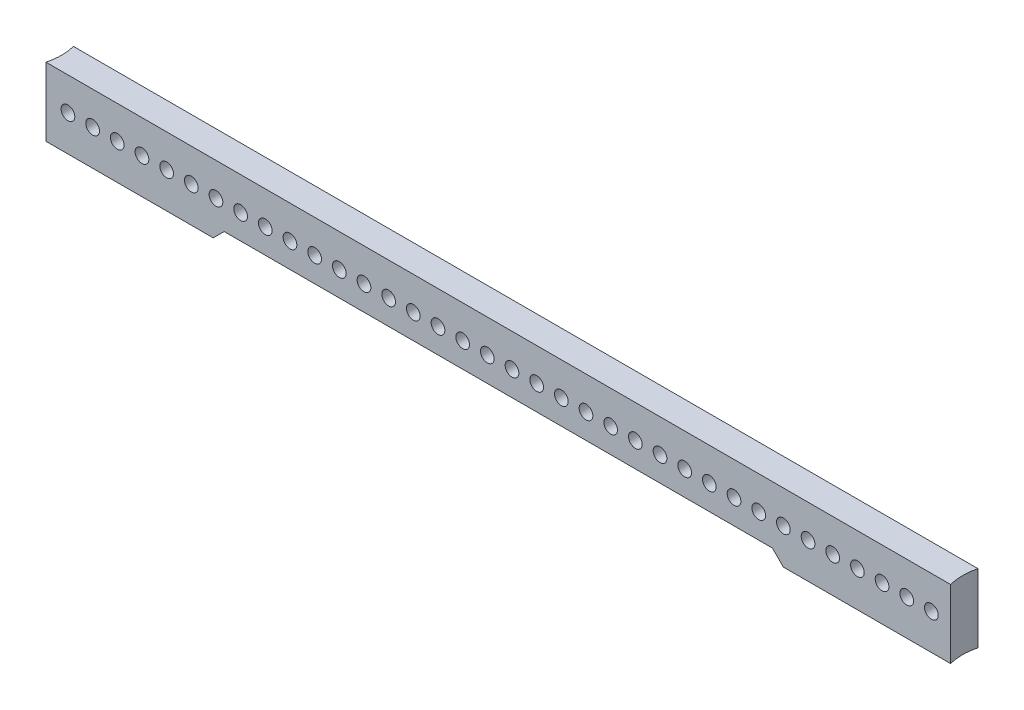
from build123d import *

# Parameters (mm, degrees)
BOSS_EXTRUDE1_DEPTH = 12.7
CUT_EXTRUDE1_REACH  = 220.591
SKETCH3_R           = 3.175
CUT_EXTRUDE2_DEPTH  = 213.321819416


with BuildPart() as part:
    # Sketch1 → Boss-Extrude1 (new body)
    with BuildSketch(Plane.XY):
        Polygon((-215.9, 0), (215.9, 0), (215.9, -31.75), (132.08, -31.75), (127, -26.67), (-127, -26.67), (-132.08, -31.75), (-215.9, -31.75), align=None)
    extrude(amount=BOSS_EXTRUDE1_DEPTH)

    # Sketch2 → Cut-Extrude1 (cut, up to next)
    with BuildSketch(Plane(origin=(0, 0, 0), x_dir=(1, 0, 0), z_dir=(0, 1, 0)), mode=Mode.PRIVATE) as cut_extrude1_sk1:
        with BuildLine():
            Line((-209.55, 0), (-215.9, 0))
            Line((-215.9, 0), (-215.9, -12.7))
            Line((-215.9, -12.7), (-209.55, -12.7))
            ThreePointArc((-209.55, -12.7), (-208.743444248, -6.35), (-209.55, 0))
        make_face()
    cut_extrude1_tool1 = extrude(cut_extrude1_sk1.sketch, amount=-CUT_EXTRUDE1_REACH, mode=Mode.PRIVATE) & part.part
    cut_extrude1 = cut_extrude1_tool1.solids().sort_by_distance((-212.451105, 0, 6.35))[0]
    add(cut_extrude1, mode=Mode.SUBTRACT)

    # Mirror1: Cut-Extrude1 across plane
    add(cut_extrude1.mirror(Plane(origin=(0, 0, 0), x_dir=(0, 0, 1), z_dir=(1, 0, 0))), mode=Mode.SUBTRACT)

    # Sketch3 → Cut-Extrude2 (cut, through all)
    with BuildSketch(Plane.XY.offset(12.7)):
        with Locations((-199.39, -15.24)):
            Circle(SKETCH3_R)
        with Locations((-187.96, -15.24)):
            Circle(SKETCH3_R)
        with Locations((-176.53, -15.24)):
            Circle(SKETCH3_R)
        with Locations((-165.1, -15.24)):
            Circle(SKETCH3_R)
        with Locations((-153.67, -15.24)):
            Circle(SKETCH3_R)
        with Locations((-142.24, -15.24)):
            Circle(SKETCH3_R)
        with Locations((-130.81, -15.24)):
            Circle(SKETCH3_R)
        with Locations((-119.38, -15.24)):
            Circle(SKETCH3_R)
        with Locations((-107.95, -15.24)):
            Circle(SKETCH3_R)
        with Locations((-96.52, -15.24)):
            Circle(SKETCH3_R)
        with Locations((-85.09, -15.24)):
            Circle(SKETCH3_R)
        with Locations((-73.66, -15.24)):
            Circle(SKETCH3_R)
        with Locations((-62.23, -15.24)):
            Circle(SKETCH3_R)
        with Locations((-50.8, -15.24)):
            Circle(SKETCH3_R)
        with Locations((-39.37, -15.24)):
            Circle(SKETCH3_R)
        with Locations((-27.94, -15.24)):
            Circle(SKETCH3_R)
        with Locations((-16.51, -15.24)):
            Circle(SKETCH3_R)
        with Locations((-5.08, -15.24)):
            Circle(SKETCH3_R)
        with Locations((6.35, -15.24)):
            Circle(SKETCH3_R)
        with Locations((17.78, -15.24)):
            Circle(SKETCH3_R)
        with Locations((29.21, -15.24)):
            Circle(SKETCH3_R)
        with Locations((40.64, -15.24)):
            Circle(SKETCH3_R)
        with Locations((52.07, -15.24)):
            Circle(SKETCH3_R)
        with Locations((63.5, -15.24)):
            Circle(SKETCH3_R)
        with Locations((74.93, -15.24)):
            Circle(SKETCH3_R)
        with Locations((86.36, -15.24)):
            Circle(SKETCH3_R)
        with Locations((97.79, -15.24)):
            Circle(SKETCH3_R)
        with Locations((109.22, -15.24)):
            Circle(SKETCH3_R)
        with Locations((120.65, -15.24)):
            Circle(SKETCH3_R)
        with Locations((132.08, -15.24)):
            Circle(SKETCH3_R)
        with Locations((143.51, -15.24)):
            Circle(SKETCH3_R)
        with Locations((154.94, -15.24)):
            Circle(SKETCH3_R)
        with Locations((166.37, -15.24)):
            Circle(SKETCH3_R)
        with Locations((177.8, -15.24)):
            Circle(SKETCH3_R)
        with Locations((189.23, -15.24)):
            Circle(SKETCH3_R)
        with Locations((200.66, -15.24)):
            Circle(SKETCH3_R)
    extrude(amount=-CUT_EXTRUDE2_DEPTH, mode=Mode.SUBTRACT)


solid = part.part
